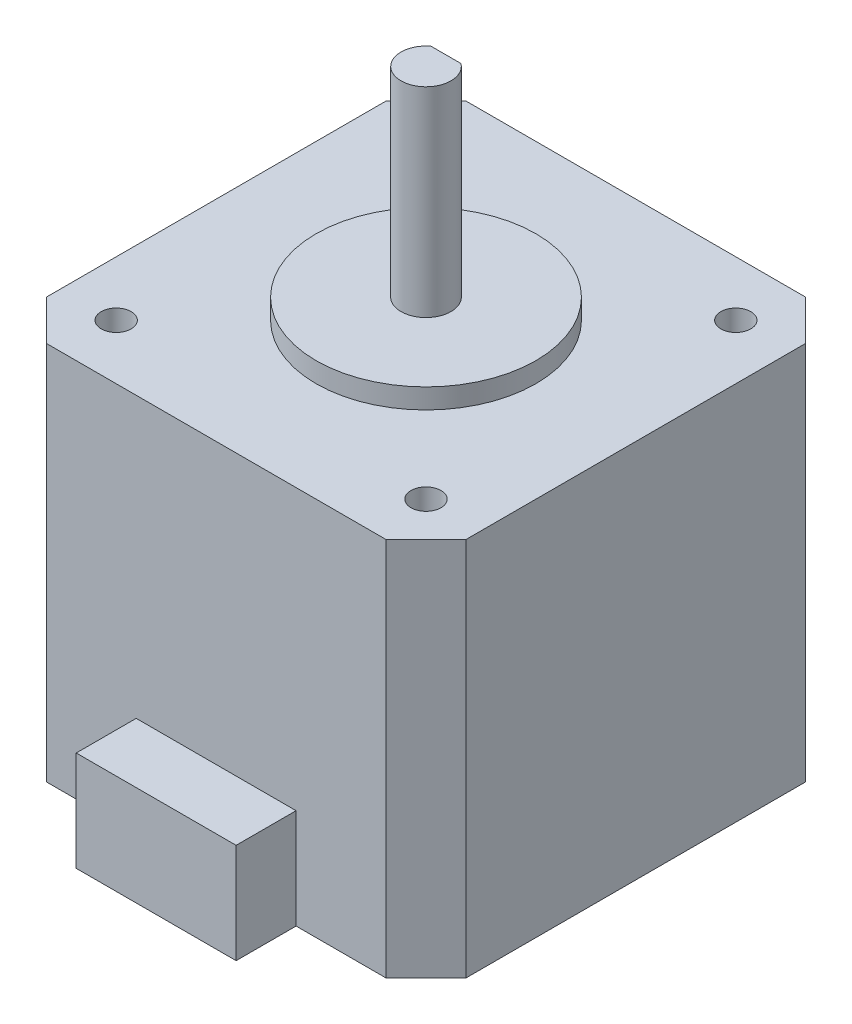
from build123d import *

# Parameters (mm, degrees)
SKETCH_1_W               = 42
SKETCH_1_H               = 42
EXTRUDE_1_DEPTH          = 38
SKETCH_2_R               = 11
EXTRUDE_2_DEPTH          = 2
SKETCH_3_R               = 2.5
EXTRUDE_3_DEPTH          = 20
CUT_EXTRUDE_START        = -15
CUT_EXTRUDE_1_DEPTH      = 15
SKETCH_5_R               = 1.5
CUT_EXTRUDE_2_DEPTH      = 4.5
PATTERN_CIRCULAR_1_COUNT = 4
SKETCH_6_W               = 16
SKETCH_6_H               = 6
EXTRUDE_4_DEPTH          = 10
CHAMFER_1_SIZE           = 4


with BuildPart() as part:
    # 草图1 → 凸台-拉伸1 (new body)
    with BuildSketch(Plane(origin=(0, 0, 0), x_dir=(1, 0, 0), z_dir=(0, 1, 0))):
        Rectangle(SKETCH_1_W, SKETCH_1_H)
    extrude(amount=EXTRUDE_1_DEPTH)

    # 草图2 → 凸台-拉伸2 (add)
    with BuildSketch(Plane(origin=(0, 38, 0), x_dir=(1, 0, 0), z_dir=(0, 1, 0))):
        with Locations(Location((0, 0, 0), (0, 0, 270))):
            Circle(SKETCH_2_R)
    extrude(amount=EXTRUDE_2_DEPTH)

    # 草图3 → 凸台-拉伸3 (add)
    with BuildSketch(Plane(origin=(0, 40, 0), x_dir=(1, 0, 0), z_dir=(0, 1, 0))):
        with Locations(Location((0, 0, 0), (0, 0, 270))):
            Circle(SKETCH_3_R)
    extrude(amount=EXTRUDE_3_DEPTH)

    # 草图4 → 切除-拉伸1 (cut)
    with BuildSketch(Plane(origin=(0, 60, 0), x_dir=(1, 0, 0), z_dir=(0, 1, 0)).offset(CUT_EXTRUDE_START)):
        with BuildLine():
            Line((-1.5, 2), (1.5, 2))
            ThreePointArc((1.5, 2), (0, 2.5), (-1.5, 2))
        make_face()
    extrude(amount=CUT_EXTRUDE_1_DEPTH, mode=Mode.SUBTRACT)

    # 草图5 → 切除-拉伸2 (cut)
    with BuildSketch(Plane(origin=(0, 38, 0), x_dir=(1, 0, 0), z_dir=(0, 1, 0))):
        with Locations(Location((15.5, 15.5, 0), (0, 0, 270))):
            Circle(SKETCH_5_R)
    cut_extrude_2 = extrude(amount=-CUT_EXTRUDE_2_DEPTH, mode=Mode.SUBTRACT)

    # 阵列(圆周)1: 切除-拉伸2 ×4 about axis
    pattern_circular_1_axis = Axis((0, 0, 0), (0, 1, 0))
    for i in range(1, PATTERN_CIRCULAR_1_COUNT):
        add(cut_extrude_2.rotate(pattern_circular_1_axis, i * 360 / PATTERN_CIRCULAR_1_COUNT), mode=Mode.SUBTRACT)

    # 草图6 → 凸台-拉伸4 (add)
    with BuildSketch(Plane.XZ):
        with Locations((0, 24)):
            Rectangle(SKETCH_6_W, SKETCH_6_H)
    extrude(amount=-EXTRUDE_4_DEPTH)

    # 倒角1
    chamfer_1_edges = [part.edges().sort_by_distance(p)[0] for p in [
        (21, 19, 21),
        (-21, 19, 21),
        (-21, 19, -21),
        (21, 19, -21),
    ]]
    chamfer(chamfer_1_edges, length=CHAMFER_1_SIZE)


solid = part.part
